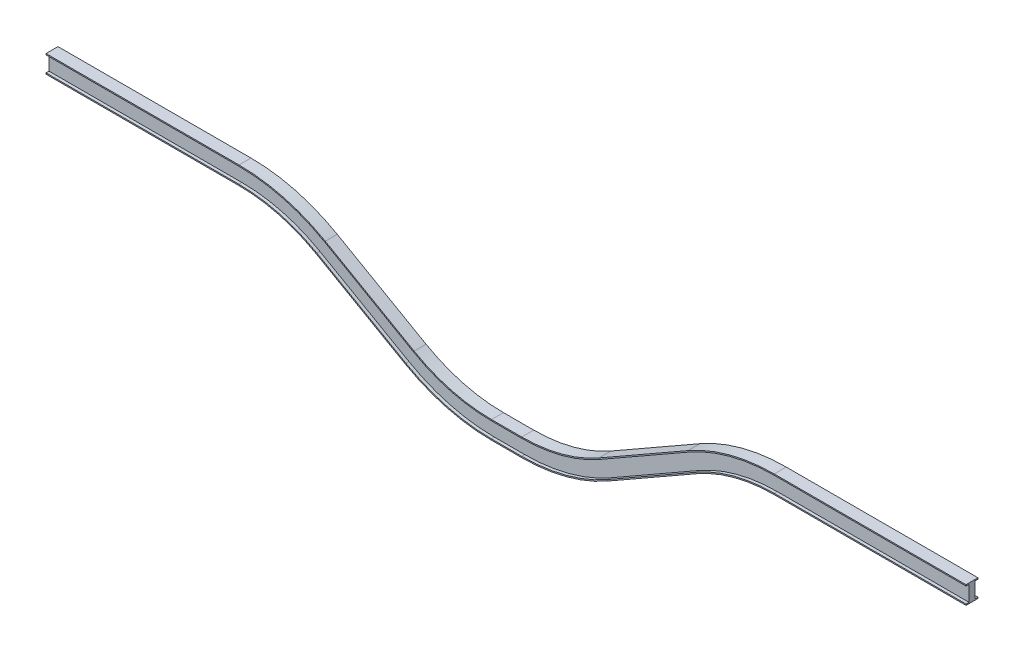
from build123d import *

# Parameters (mm, degrees)
CROQUIS2_W              = 101.6
CROQUIS2_H              = 152.4
SALIENTE_EXTRUIR1_DEPTH = 10
CROQUIS4_W              = 101.6
CROQUIS4_H              = 152.4
CORTAR_EXTRUIR2_DEPTH   = 25.4
CORTAR_EXTRUIR3_START   = -25.4
CORTAR_EXTRUIR3_DEPTH   = 25.4


with BuildPart() as part:
    # Croquis2 → Saliente-Extruir1 (new body)
    with BuildSketch(Plane(origin=(0, 0, 0), x_dir=(0, 0, -1), z_dir=(1, 0, 0))):
        with Locations((50.8, -76.2)):
            Rectangle(CROQUIS2_W, CROQUIS2_H)
    extrude(amount=SALIENTE_EXTRUIR1_DEPTH)

    # Barrer1: sweep along a curve in space
    with BuildLine() as barrer1_path:
        Line((10, -76.2, -50.8), (1638.209788096, -76.2, -50.8))
        ThreePointArc((1638.209788096, -76.2, -50.8), (1997.544897315, -123.100491729, -50.8), (2332.804301795, -260.659601026, -50.8))
        Line((3087.195698205, -691.740398974, -50.8), (2332.804301795, -260.659601026, -50.8))
        ThreePointArc((3087.195698205, -691.740398974, -50.8), (3422.455102685, -829.299508271, -50.8), (3781.790211904, -876.2, -50.8))
        Line((3781.790211904, -876.2, -50.8), (4038.209788096, -876.2, -50.8))
        ThreePointArc((4038.209788096, -876.2, -50.8), (4397.544897315, -829.299508271, -50.8), (4732.804301795, -691.740398974, -50.8))
        Line((5487.195698205, -260.659601026, -50.8), (4732.804301795, -691.740398974, -50.8))
        ThreePointArc((5487.195698205, -260.659601026, -50.8), (5822.455102685, -123.100491729, -50.8), (6181.790211904, -76.2, -50.8))
        Line((6181.790211904, -76.2, -50.8), (7810, -76.2, -50.8))
    # Croquis4 → Barrer1 (sweep)
    with BuildSketch(Plane(origin=(10, 0, 0), x_dir=(0, 0, -1), z_dir=(1, 0, 0))):
        with Locations((50.8, -76.2)):
            Rectangle(CROQUIS4_W, CROQUIS4_H)
    sweep(path=barrer1_path.line)

    # Croquis6 → Cortar-Extruir2 (cut)
    with BuildSketch(Plane.XY):
        with BuildLine():
            Line((1638.209788096, -142.4), (10, -142.4))
            Line((10, -142.4), (0, -142.4))
            Line((0, -142.4), (0, -10))
            Line((0, -10), (10, -10))
            Line((10, -10), (1638.209788096, -10))
            ThreePointArc((1638.209788096, -10), (2014.536314623, -59.118214981), (2365.648699514, -203.181905017))
            Line((2365.648699514, -203.181905017), (3120.040095924, -634.262702966))
            ThreePointArc((3120.040095924, -634.262702966), (3439.446519992, -765.317231522), (3781.790211905, -810))
            Line((3781.790211905, -810), (4038.209788096, -810))
            ThreePointArc((4038.209788096, -810), (4380.553480008, -765.317231522), (4699.959904076, -634.262702966))
            Line((4699.959904076, -634.262702966), (5454.351300486, -203.181905017))
            ThreePointArc((5454.351300486, -203.181905017), (5805.463685377, -59.118214981), (6181.790211904, -10))
            Line((6181.790211904, -10), (7800, -10))
            Line((7800, -10), (7810, -10))
            Line((7810, -10), (7810, -142.4))
            Line((7810, -142.4), (7800, -142.4))
            Line((7800, -142.4), (6181.790211904, -142.4))
            ThreePointArc((6181.790211904, -142.4), (5839.446519992, -187.082768478), (5520.040095924, -318.137297034))
            Line((5520.040095924, -318.137297034), (4765.648699514, -749.218094983))
            ThreePointArc((4765.648699514, -749.218094983), (4414.536314623, -893.281785019), (4038.209788096, -942.4))
            Line((4038.209788096, -942.4), (3781.790211905, -942.4))
            ThreePointArc((3781.790211905, -942.4), (3405.463685377, -893.281785019), (3054.351300486, -749.218094983))
            Line((3054.351300486, -749.218094983), (2299.959904076, -318.137297034))
            ThreePointArc((2299.959904076, -318.137297034), (1980.553480008, -187.082768478), (1638.209788096, -142.4))
        make_face()
    extrude(amount=-CORTAR_EXTRUIR2_DEPTH, mode=Mode.SUBTRACT)

    # Croquis7 → Cortar-Extruir3 (cut)
    with BuildSketch(Plane(origin=(0, 0, -101.6), x_dir=(-1, 0, 0), z_dir=(0, 0, -1)).offset(CORTAR_EXTRUIR3_START)):
        with BuildLine():
            Line((0, -10), (-1638.209788096, -10))
            ThreePointArc((-1638.209788096, -10), (-2014.536314623, -59.118214981), (-2365.648699514, -203.181905017))
            Line((-2365.648699514, -203.181905017), (-3120.040095924, -634.262702966))
            ThreePointArc((-3120.040095924, -634.262702966), (-3439.446519992, -765.317231522), (-3781.790211904, -810))
            Line((-3781.790211904, -810), (-4038.209788096, -810))
            ThreePointArc((-4038.209788096, -810), (-4380.553480008, -765.317231522), (-4699.959904076, -634.262702966))
            Line((-4699.959904076, -634.262702966), (-5454.351300486, -203.181905017))
            ThreePointArc((-5454.351300486, -203.181905017), (-5805.463685377, -59.118214981), (-6181.790211904, -10))
            Line((-6181.790211904, -10), (-7810, -10))
            Line((-7810, -10), (-7810, -142.4))
            Line((-7810, -142.4), (-6181.790211904, -142.4))
            ThreePointArc((-6181.790211904, -142.4), (-5839.446519992, -187.082768478), (-5520.040095924, -318.137297034))
            Line((-5520.040095924, -318.137297034), (-4765.648699514, -749.218094983))
            ThreePointArc((-4765.648699514, -749.218094983), (-4414.536314623, -893.281785019), (-4038.209788096, -942.4))
            Line((-4038.209788096, -942.4), (-3781.790211905, -942.4))
            ThreePointArc((-3781.790211905, -942.4), (-3405.463685377, -893.281785019), (-3054.351300486, -749.218094983))
            Line((-3054.351300486, -749.218094983), (-2299.959904076, -318.137297034))
            ThreePointArc((-2299.959904076, -318.137297034), (-1980.553480008, -187.082768478), (-1638.209788096, -142.4))
            Line((-1638.209788096, -142.4), (0, -142.4))
            Line((0, -142.4), (0, -10))
        make_face()
    extrude(amount=CORTAR_EXTRUIR3_DEPTH, mode=Mode.SUBTRACT)


solid = part.part
